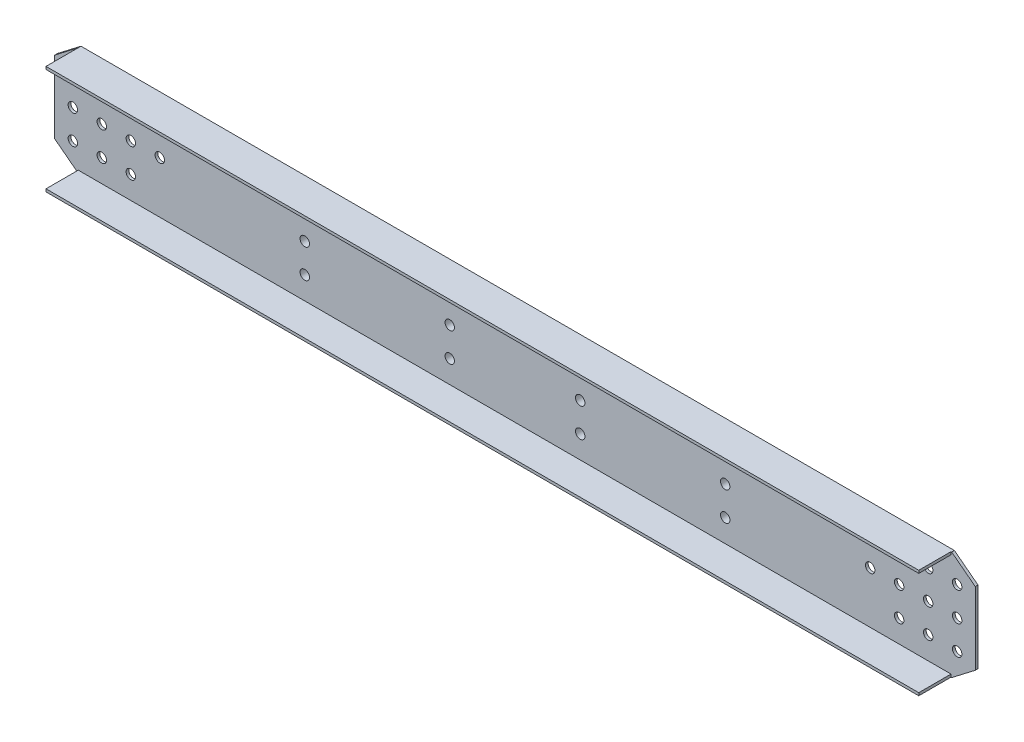
from build123d import *

# Parameters (mm, degrees)
SKETCH_1_R          = 13
EXTRUDE_689_DEPTH   = 7.5
SKETCH_2_W          = 2408.049034164
SKETCH_2_H          = 7.5
EXTRUDE_1_DEPTH     = 89
SKETCH_3_W          = 80
SKETCH_3_H          = 240
EXTRUDE_2_DEPTH     = 16
SKETCH_4_R          = 13
CUT_EXTRUDE_1_DEPTH = 1308.983562588


with BuildPart() as part:
    # 草图1 → Extrude 689 (new body)
    with BuildSketch(Plane.XY):
        Polygon((-1205, 0), (1205, 0), (1270, 50), (1270, 250), (1205, 300), (-1205, 300), (-1270, 250), (-1270, 50), align=None)
        with Locations((-1220, 230)):
            Circle(SKETCH_1_R, mode=Mode.SUBTRACT)
        with Locations((-1220, 150)):
            Circle(SKETCH_1_R, mode=Mode.SUBTRACT)
        with Locations((-1140, 230)):
            Circle(SKETCH_1_R, mode=Mode.SUBTRACT)
        with Locations((-1140, 150)):
            Circle(SKETCH_1_R, mode=Mode.SUBTRACT)
        with Locations((-1060, 230)):
            Circle(SKETCH_1_R, mode=Mode.SUBTRACT)
        with Locations((-1060, 150)):
            Circle(SKETCH_1_R, mode=Mode.SUBTRACT)
        with Locations((-980, 150)):
            Circle(SKETCH_1_R, mode=Mode.SUBTRACT)
        with Locations(Location((-1060, 70, 0), (0, 0, 180))):
            Circle(SKETCH_1_R, mode=Mode.SUBTRACT)
        with Locations(Location((-1140, 70, 0), (0, 0, 180))):
            Circle(SKETCH_1_R, mode=Mode.SUBTRACT)
        with Locations(Location((-1220, 70, 0), (0, 0, 180))):
            Circle(SKETCH_1_R, mode=Mode.SUBTRACT)
        with Locations((1220, 70)):
            Circle(SKETCH_1_R, mode=Mode.SUBTRACT)
        with Locations((1140, 70)):
            Circle(SKETCH_1_R, mode=Mode.SUBTRACT)
        with Locations((1060, 70)):
            Circle(SKETCH_1_R, mode=Mode.SUBTRACT)
        with Locations(Location((980, 150, 0), (0, 0, 180))):
            Circle(SKETCH_1_R, mode=Mode.SUBTRACT)
        with Locations(Location((1060, 150, 0), (0, 0, 180))):
            Circle(SKETCH_1_R, mode=Mode.SUBTRACT)
        with Locations(Location((1060, 230, 0), (0, 0, 180))):
            Circle(SKETCH_1_R, mode=Mode.SUBTRACT)
        with Locations(Location((1140, 150, 0), (0, 0, 180))):
            Circle(SKETCH_1_R, mode=Mode.SUBTRACT)
        with Locations(Location((1140, 230, 0), (0, 0, 180))):
            Circle(SKETCH_1_R, mode=Mode.SUBTRACT)
        with Locations(Location((1220, 150, 0), (0, 0, 180))):
            Circle(SKETCH_1_R, mode=Mode.SUBTRACT)
        with Locations(Location((1220, 230, 0), (0, 0, 180))):
            Circle(SKETCH_1_R, mode=Mode.SUBTRACT)
    extrude(amount=-EXTRUDE_689_DEPTH)

    # 草图2 → 凸台-拉伸1 (add)
    with BuildSketch(Plane.XY):
        with Locations((-0.975482918, 296.25)):
            Rectangle(SKETCH_2_W, SKETCH_2_H)
        with Locations((-0.975482918, 3.75)):
            Rectangle(SKETCH_2_W, SKETCH_2_H)
    extrude(amount=EXTRUDE_1_DEPTH)

    # 草图3 → 凸台-拉伸2 (add)
    with BuildSketch(Plane(origin=(0, 0, -7.5), x_dir=(-1, 0, 0), z_dir=(0, 0, -1))):
        with Locations((-580, 150)):
            Rectangle(SKETCH_3_W, SKETCH_3_H)
        with Locations((-180, 150)):
            Rectangle(SKETCH_3_W, SKETCH_3_H)
        with Locations((180, 150)):
            Rectangle(SKETCH_3_W, SKETCH_3_H)
        with Locations((580, 150)):
            Rectangle(SKETCH_3_W, SKETCH_3_H)
    extrude(amount=EXTRUDE_2_DEPTH)

    # 草图4 → 切除-拉伸1 (cut, through all)
    with BuildSketch(Plane.XY):
        with Locations((-580, 230)):
            Circle(SKETCH_4_R)
        with Locations((-580, 150)):
            Circle(SKETCH_4_R)
        with Locations((-180, 230)):
            Circle(SKETCH_4_R)
        with Locations((-180, 150)):
            Circle(SKETCH_4_R)
        with Locations(Location((-180, 70, 0), (0, 0, 180))):
            Circle(SKETCH_4_R)
        with Locations(Location((-580, 70, 0), (0, 0, 180))):
            Circle(SKETCH_4_R)
        with Locations((580, 70)):
            Circle(SKETCH_4_R)
        with Locations((180, 70)):
            Circle(SKETCH_4_R)
        with Locations(Location((180, 150, 0), (0, 0, 180))):
            Circle(SKETCH_4_R)
        with Locations(Location((180, 230, 0), (0, 0, 180))):
            Circle(SKETCH_4_R)
        with Locations(Location((580, 150, 0), (0, 0, 180))):
            Circle(SKETCH_4_R)
        with Locations(Location((580, 230, 0), (0, 0, 180))):
            Circle(SKETCH_4_R)
    extrude(amount=-CUT_EXTRUDE_1_DEPTH, mode=Mode.SUBTRACT)


solid = part.part
